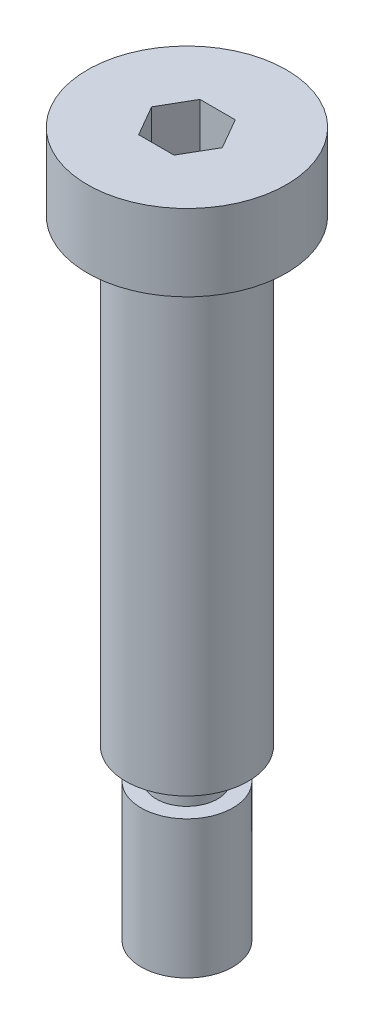
from build123d import *

# Parameters (mm, degrees)
CUT_EXTRUDE_1_DEPTH = 3


with BuildPart() as part:
    # 草图1 → 旋转1 (revolve)
    with BuildSketch(Plane.XY, mode=Mode.PRIVATE) as revolve_1_sk:
        Polygon((0, 46), (6.5, 46), (6.5, 41), (4, 41), (4, 11), (2, 11), (2, 9), (3, 9), (3, 0), (0, 0), align=None)
    revolve(revolve_1_sk.sketch.rotate(Axis((0, 0, 0), (0, 1, 0)), 90), axis=Axis((0, 0, 0), (0, 1, 0)))

    # 草图2 → 切除-拉伸1 (cut)
    with BuildSketch(Plane(origin=(0, 46, 0), x_dir=(1, 0, 0), z_dir=(0, 1, 0))):
        Polygon((1.154700538, 2), (-1.154700538, 2), (-2.309401077, 0), (-1.154700538, -2), (1.154700538, -2), (2.309401077, 0), align=None)
    extrude(amount=-CUT_EXTRUDE_1_DEPTH, mode=Mode.SUBTRACT)


solid = part.part
